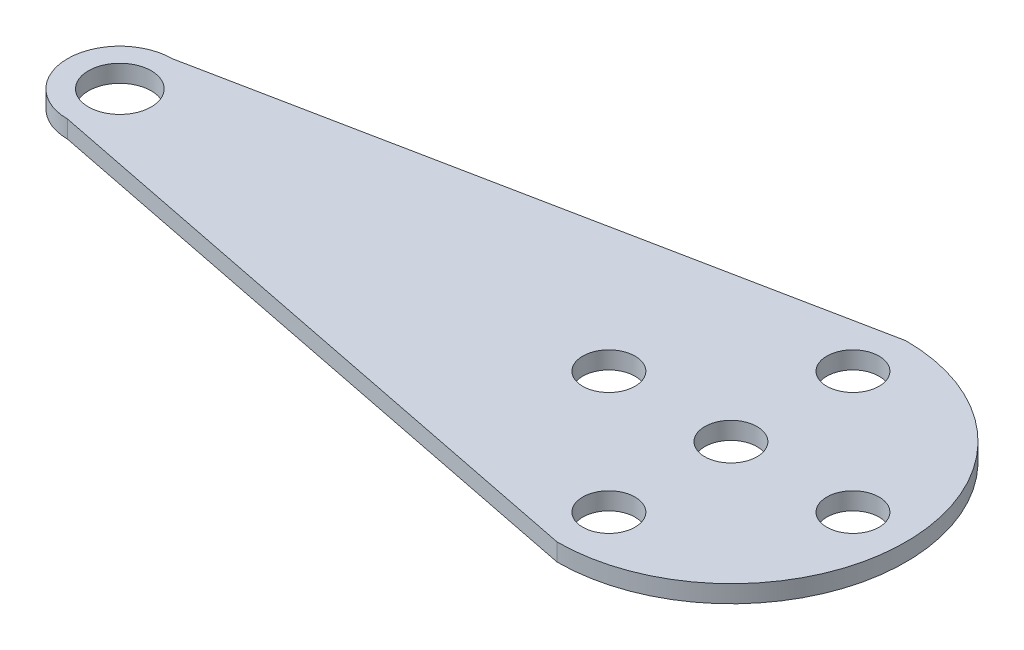
from build123d import *

# Parameters (mm, degrees)
BOSS_EXTRUDE1_DEPTH = 1
SKETCH5_R           = 1.5
SKETCH5_R_2         = 1.8
CUT_EXTRUDE4_DEPTH  = 11


with BuildPart() as part:
    # Sketch1 → Boss-Extrude1 (new body)
    with BuildSketch(Plane(origin=(0, 0, 0), x_dir=(1, 0, 0), z_dir=(0, 1, 0))):
        with BuildLine():
            Line((0.003114812, 10.031035213), (0.003114812, 0.031035213))
            Line((0.003114812, 0.031035213), (0.003114812, -9.968964787))
            ThreePointArc((0.003114812, -9.968964787), (7.074182624, -7.040032599), (10.003114812, 0.031035213))
            ThreePointArc((10.003114812, 0.031035213), (7.074182624, 7.102103025), (0.003114812, 10.031035213))
        make_face()
        with BuildLine():
            Line((-32.050001176, 0.002656129), (-9.996881269, 0.022181449))
            ThreePointArc((-9.996881269, 0.022181449), (-8.322945106, 5.569692653), (-3.853372565, 9.257492015))
            Line((-3.853372565, 9.257492015), (-35.05, 3))
            ThreePointArc((-35.05, 3), (-32.929618948, 2.122259219), (-32.050001176, 0.002656129))
        make_face()
        with BuildLine():
            Line((-9.996881269, 0.022181449), (0.003114812, 0.031035213))
            Line((0.003114812, 0.031035213), (0.003114812, 10.031035213))
            Line((0.003114812, 10.031035213), (-3.853372565, 9.257492015))
            ThreePointArc((-3.853372565, 9.257492015), (-8.322945106, 5.569692653), (-9.996881269, 0.022181449))
        make_face()
        with BuildLine():
            Line((0.003114812, -9.968964787), (0.003114812, 0.031035213))
            Line((0.003114812, 0.031035213), (-9.996881269, 0.022181449))
            ThreePointArc((-9.996881269, 0.022181449), (-8.308581959, -5.529153344), (-3.821927798, -9.20850206))
            Line((-3.821927798, -9.20850206), (0.003114812, -9.968964787))
        make_face()
        with BuildLine():
            ThreePointArc((-3.821927798, -9.20850206), (-8.308581959, -5.529153344), (-9.996881269, 0.022181449))
            Line((-9.996881269, 0.022181449), (-32.050001176, 0.002656129))
            ThreePointArc((-32.050001176, 0.002656129), (-32.050000294, 0.001328065), (-32.05, 0))
            ThreePointArc((-32.05, 0), (-32.928679656, -2.121320344), (-35.05, -3))
            Line((-35.05, -3), (-3.821927798, -9.20850206))
        make_face()
        with BuildLine():
            ThreePointArc((-32.05, 0), (-32.050000294, 0.001328065), (-32.050001176, 0.002656129))
            Line((-32.050001176, 0.002656129), (-35.05, 0))
            Line((-35.05, 0), (-35.05, -3))
            ThreePointArc((-35.05, -3), (-32.928679656, -2.121320344), (-32.05, 0))
        make_face()
        with BuildLine():
            Line((-35.05, 0), (-32.050001176, 0.002656129))
            ThreePointArc((-32.050001176, 0.002656129), (-32.929618948, 2.122259219), (-35.05, 3))
            Line((-35.05, 3), (-35.05, 0))
        make_face()
        with BuildLine():
            Line((-35.05, 0), (-35.05, 3))
            ThreePointArc((-35.05, 3), (-38.05, 0), (-35.05, -3))
            Line((-35.05, -3), (-35.05, 0))
        make_face()
    extrude(amount=BOSS_EXTRUDE1_DEPTH)

    # Sketch5 → Cut-Extrude4 (cut)
    with BuildSketch(Plane.XZ):
        with Locations(Location((0, 0, 0), (0, 0, 270))):
            Circle(SKETCH5_R)
        with Locations(Location((0, 7, 0), (0, 0, 270))):
            Circle(SKETCH5_R)
        with Locations(Location((-35.05, 0, 0), (0, 0, 270))):
            Circle(SKETCH5_R_2)
        with Locations(Location((-7, 0, 0), (0, 0, 270))):
            Circle(SKETCH5_R)
        with Locations(Location((7, 0, 0), (0, 0, 270))):
            Circle(SKETCH5_R)
        with Locations(Location((0, -7, 0), (0, 0, 270))):
            Circle(SKETCH5_R)
    extrude(amount=-CUT_EXTRUDE4_DEPTH, mode=Mode.SUBTRACT)


solid = part.part
